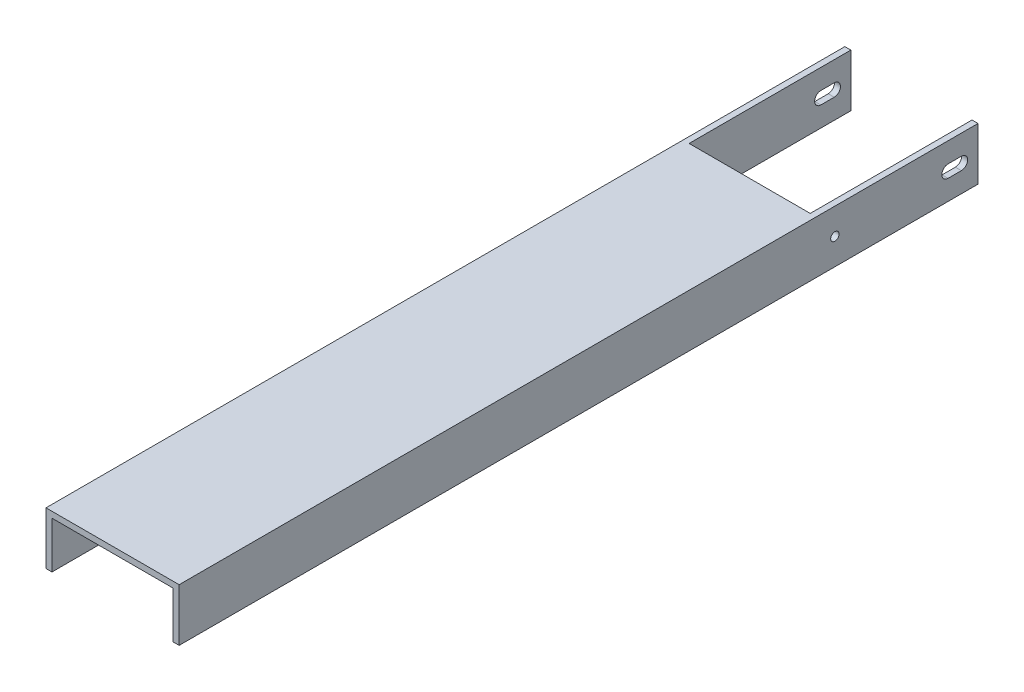
from build123d import *

# Parameters (mm, degrees)
BOSS_EXTRUDE1_DEPTH = 609.6
SKETCH3_W           = 92.456
SKETCH3_H           = 123.444
CUT_EXTRUDE1_DEPTH  = 614.028039672
SKETCH4_R           = 3.175
CUT_EXTRUDE2_DEPTH  = 620.310340156


with BuildPart() as part:
    # Sketch1 → Boss-Extrude1 (new body)
    with BuildSketch(Plane.XY):
        Polygon((-50.8, 0), (50.8, 0), (50.8, -40.132), (46.228, -40.132), (46.228, -4.572), (-46.228, -4.572), (-46.228, -40.132), (-50.8, -40.132), align=None)
    extrude(amount=BOSS_EXTRUDE1_DEPTH)

    # Sketch3 → Cut-Extrude1 (cut, through all)
    with BuildSketch(Plane(origin=(0, 0, 0), x_dir=(1, 0, 0), z_dir=(0, 1, 0))):
        with Locations((0, -61.722)):
            Rectangle(SKETCH3_W, SKETCH3_H)
    extrude(amount=-CUT_EXTRUDE1_DEPTH, mode=Mode.SUBTRACT)

    # Sketch4 → Cut-Extrude2 (cut, through all)
    with BuildSketch(Plane(origin=(50.8, 0, 0), x_dir=(0, 0, -1), z_dir=(1, 0, 0))):
        with Locations(Location((-109.22, -20.066, 0), (0, 0, 90))):
            Circle(SKETCH4_R)
        with BuildLine():
            Line((-12.7, -24.8285), (-22.86, -24.8285))
            ThreePointArc((-22.86, -24.8285), (-27.6225, -20.066), (-22.86, -15.3035))
            Line((-22.86, -15.3035), (-12.7, -15.3035))
            ThreePointArc((-12.7, -15.3035), (-7.9375, -20.066), (-12.7, -24.8285))
        make_face()
    extrude(amount=-CUT_EXTRUDE2_DEPTH, mode=Mode.SUBTRACT)


solid = part.part
